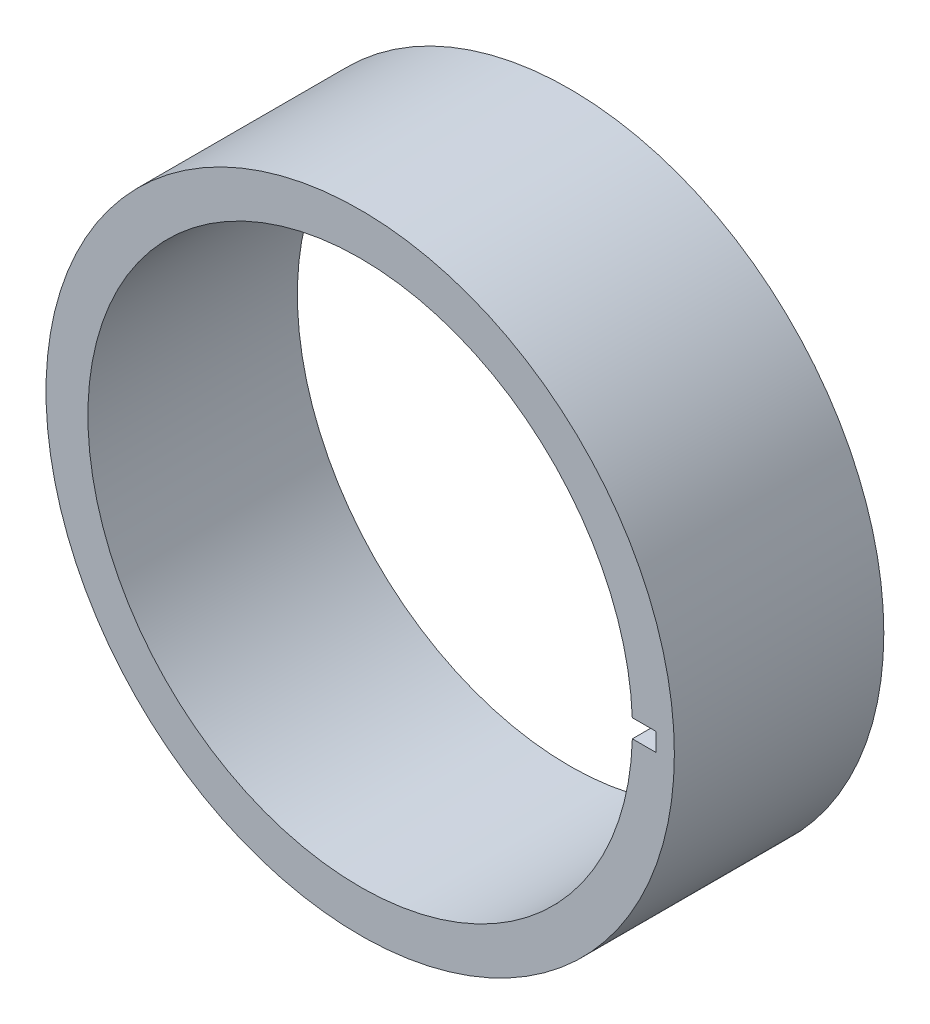
from build123d import *

# Parameters (mm, degrees)
BOSS_EXTRUDE1_DEPTH      = 20
BOSS_EXTRUDE1_DEPTH_BACK = 20
SKETCH1_R                = 60
SKETCH1_R_2              = 52
CUT_EXTRUDE1_DEPTH       = 20
CUT_EXTRUDE1_DEPTH_BACK  = 20


with BuildPart() as part:
    # Sketch1 → Boss-Extrude1 (new, two sides: drawn at the far end of the back side and taken through both)
    with BuildSketch(Plane.XY.offset(-BOSS_EXTRUDE1_DEPTH_BACK)):
        Circle(SKETCH1_R)
        Circle(SKETCH1_R_2, mode=Mode.SUBTRACT)
    extrude(amount=BOSS_EXTRUDE1_DEPTH + BOSS_EXTRUDE1_DEPTH_BACK)

    # Sketch2 → Cut-Extrude1 (cut, two sides: drawn at the far end of the back side and taken through both)
    with BuildSketch(Plane.XY.offset(-CUT_EXTRUDE1_DEPTH_BACK)):
        Polygon((51.978001404, -1.512405375), (56.465581727, -1.512405375), (56.465581727, 1.971821564), (51.962601164, 1.971821564), align=None)
    extrude(amount=CUT_EXTRUDE1_DEPTH + CUT_EXTRUDE1_DEPTH_BACK, mode=Mode.SUBTRACT)


solid = part.part
